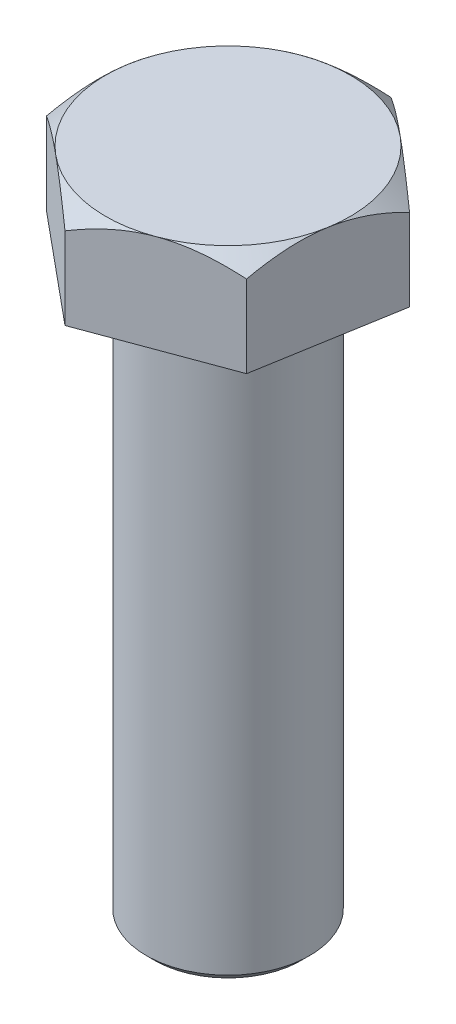
from build123d import *

# Parameters (mm, degrees)
SKETCH1_W           = 10
SKETCH1_H           = 70
BOSS_EXTRUDE1_DEPTH = 12
SKETCH3_OUTSIDE_W   = 60.55
SKETCH3_OUTSIDE_H   = 62.214
SKETCH3_OUTSIDE_R   = 15
CUT_EXTRUDE1_DEPTH  = 3
CUT_EXTRUDE1_DRAFT  = -50
CHAMFER1_SIZE       = 1


with BuildPart() as part:
    # Sketch1 → Revolve1 (revolve)
    with BuildSketch(Plane.XY):
        with Locations((5, 35)):
            Rectangle(SKETCH1_W, SKETCH1_H)
    revolve(axis=Axis((0, 70, 0), (0, -1, 0)))

    # Sketch2 → Boss-Extrude1 (add)
    with BuildSketch(Plane(origin=(0, 70, 0), x_dir=(1, 0, 0), z_dir=(0, 1, 0))):
        Polygon((13.331465099, -11.057668756), (16.241954599, 6.016553068), (2.9104895, 17.074221823), (-13.331465099, 11.057668756), (-16.241954599, -6.016553068), (-2.9104895, -17.074221823), align=None)
    extrude(amount=BOSS_EXTRUDE1_DEPTH)


with BuildPart() as cut_extrude1_tool:
    # Sketch3 outside → Cut-Extrude1 (with draft: the straight prism first)
    with BuildSketch(Plane(origin=(0, 82, 0), x_dir=(1, 0, 0), z_dir=(0, 1, 0))):
        Rectangle(SKETCH3_OUTSIDE_W, SKETCH3_OUTSIDE_H)
        Circle(SKETCH3_OUTSIDE_R, mode=Mode.SUBTRACT)
    extrude(amount=-CUT_EXTRUDE1_DEPTH)
    # Cut-Extrude1: the draft: its side faces are tilted about the plane it starts from
    cut_extrude1_sides = [cut_extrude1_tool.faces().sort_by_distance(p)[0] for p in [
        (0, 80.5, 31.107),
        (30.275, 80.5, 0),
        (0, 80.5, -31.107),
        (-30.275, 80.5, 0),
        (-15, 80.5, 0),
    ]]
    draft(cut_extrude1_sides, Plane(origin=(0, 82, 0), x_dir=(1, 0, 0), z_dir=(0, 1, 0)), CUT_EXTRUDE1_DRAFT)


with BuildPart() as part_1:
    add(part.part)

    # Cut-Extrude1: cut by cut_extrude1_tool
    add(cut_extrude1_tool.part, mode=Mode.SUBTRACT)

    # Chamfer1
    chamfer1_edges = [part_1.edges().sort_by_distance(p)[0] for p in [
        (-10, 0, 0),
    ]]
    chamfer(chamfer1_edges, length=CHAMFER1_SIZE)


solid = part_1.part
